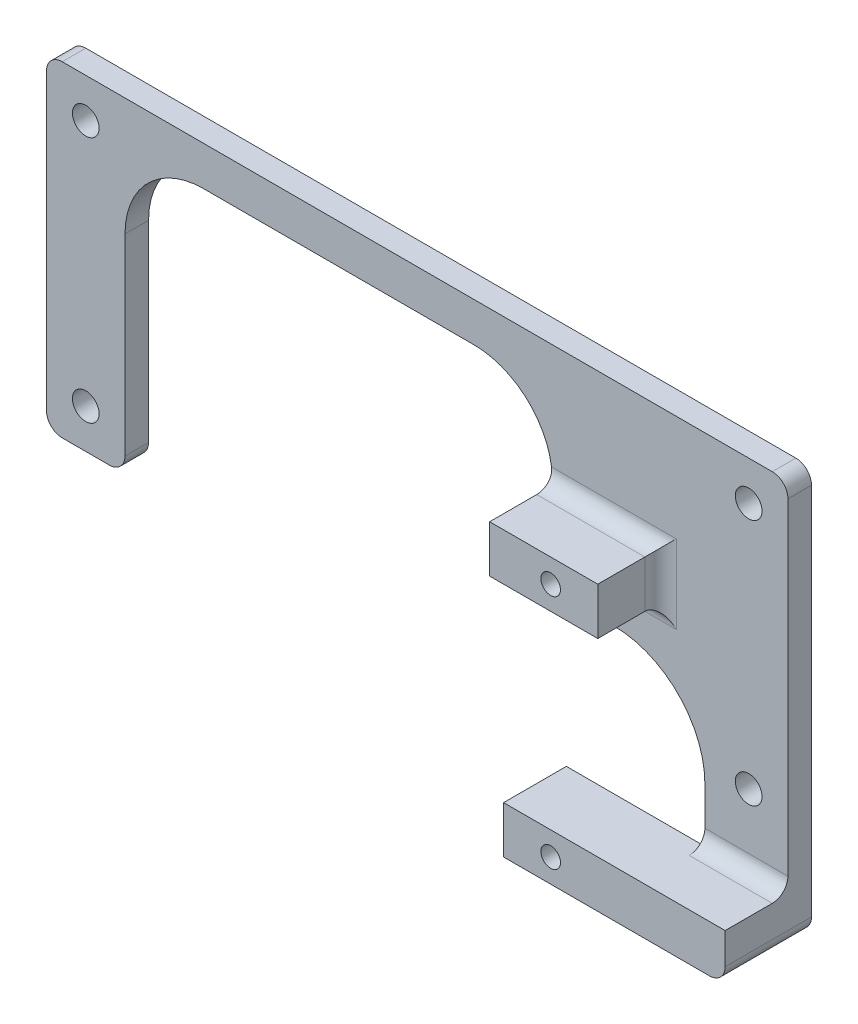
from build123d import *

# Parameters (mm, degrees)
BOSS_EXTRUDE1_DEPTH         = 3
FILLET1_R                   = 10
M3_CLEARANCE_HOLE1_D        = 3.4
CUT_EXTRUDE1_DEPTH          = 61.741531853
SKETCH7_W                   = 13.775
SKETCH7_H                   = 6
SKETCH7_W_2                 = 28.225
BOSS_EXTRUDE2_DEPTH         = 8
SKETCH15_W                  = 10.578557518
SKETCH15_H                  = 3
BOSS_EXTRUDE3_DEPTH         = 10.125
FILLET2_R                   = 2
TAP_DRILL_FOR_M3X0_5_TAP1_D = 2.5


with BuildPart() as part:
    # Sketch1 → Boss-Extrude1 (new body)
    with BuildSketch(Plane.XY):
        Polygon((23.474558014, 7.846809304), (23.474558014, -28.653190696), (53.474558014, -28.653190696), (53.474558014, 12.846809304), (-40.975441986, 12.846809304), (-40.975441986, -28.653190696), (-30.975441986, -28.653190696), (-30.975441986, 7.846809304), align=None)
    extrude(amount=BOSS_EXTRUDE1_DEPTH)

    # Fillet1
    fillet1_edges = [part.edges().sort_by_distance(p)[0] for p in [
        (23.474558014, 7.846809304, 1.5),
        (-30.975441986, 7.846809304, 1.5),
    ]]
    fillet(fillet1_edges, radius=FILLET1_R)

    # M3 Clearance Hole1 (through all)
    with Locations(Plane(origin=(0, 0, 0), x_dir=(-1, 0, 0), z_dir=(0, 0, -1))):
        with Locations((-48.474558014, 7.846809304), (35.975441986, -23.653190696), (35.975441986, 7.846809304), (-48.474558014, -23.653190696), (-29.467521423, -37.965948117)):
            Hole(M3_CLEARANCE_HOLE1_D / 2)

    # Sketch5 → Cut-Extrude1 (cut, through all)
    with BuildSketch(Plane.XY.offset(3)):
        with BuildLine():
            Line((23.474558014, -14.256748214), (23.474558014, -17.232031749))
            ThreePointArc((23.474558014, -17.232031749), (25.270647998, -35.897802119), (42.566674364, -28.653190696))
            Line((42.566674364, -28.653190696), (42.896000496, -28.653190696))
            Line((42.896000496, -28.653190696), (42.896000496, -25.903190696))
            ThreePointArc((42.896000496, -25.903190696), (39.48483647, -17.667912241), (31.249558014, -14.256748214))
            Line((31.249558014, -14.256748214), (23.474558014, -14.256748214))
        make_face()
    extrude(amount=-CUT_EXTRUDE1_DEPTH, mode=Mode.SUBTRACT)

    # Sketch7 → Boss-Extrude2 (add)
    with BuildSketch(Plane.XY.offset(3)):
        with Locations((30.362058014, -5.678190696)):
            Rectangle(SKETCH7_W, SKETCH7_H)
        with Locations((39.362058014, -35.778190696)):
            Rectangle(SKETCH7_W_2, SKETCH7_H)
    extrude(amount=BOSS_EXTRUDE2_DEPTH)


with BuildPart() as boss_extrude2_piece_1:
    # of the separate pieces the step leaves, piece 1, a body of its own (boss_extrude2_pieces)
    add(part.part.solids().sort_by_distance((-20.975441986, 7.846809304, 0))[0])



with BuildPart() as boss_extrude2_piece_2:
    # of the separate pieces the step leaves, piece 2, a body of its own (boss_extrude2_pieces)
    add(part.part.solids().sort_by_distance((53.474558014, -38.778190696, 3))[0])


with BuildPart() as boss_extrude2_piece_1_1:
    add(boss_extrude2_piece_1.part)

    add(boss_extrude2_piece_2.part)  # Boss-Extrude3 merges Boss-Extrude2 piece 2
    # Sketch15 → Boss-Extrude3 (add)
    with BuildSketch(Plane.XZ.offset(28.653190696)):
        with Locations((48.185279255, 1.5)):
            Rectangle(SKETCH15_W, SKETCH15_H)
    extrude(amount=BOSS_EXTRUDE3_DEPTH)

    # Fillet2
    fillet2_edges = [boss_extrude2_piece_1_1.edges().sort_by_distance(p)[0] for p in [
        (53.474558014, -38.778190696, 5.5),
        (48.185279255, -32.778190696, 3),
        (-40.975441986, -28.653190696, 1.5),
        (-40.975441986, 12.846809304, 1.5),
        (53.474558014, 12.846809304, 1.5),
        (-30.975441986, -28.653190696, 1.5),
        (23.474558014, -14.256748214, 1.5),
        (30.362058014, -2.678190696, 3),
        (37.249558014, -5.678190696, 3),
        (30.362058014, -8.678190696, 3),
    ]]
    fillet(fillet2_edges, radius=FILLET2_R)

    # Tap Drill for M3x0.5 Tap1 (through all)
    with Locations(Plane.XY.offset(11)):
        with Locations((31.249558014, -35.778190696), (31.249558014, -5.678190696)):
            Hole(TAP_DRILL_FOR_M3X0_5_TAP1_D / 2)


solid = boss_extrude2_piece_1_1.part
